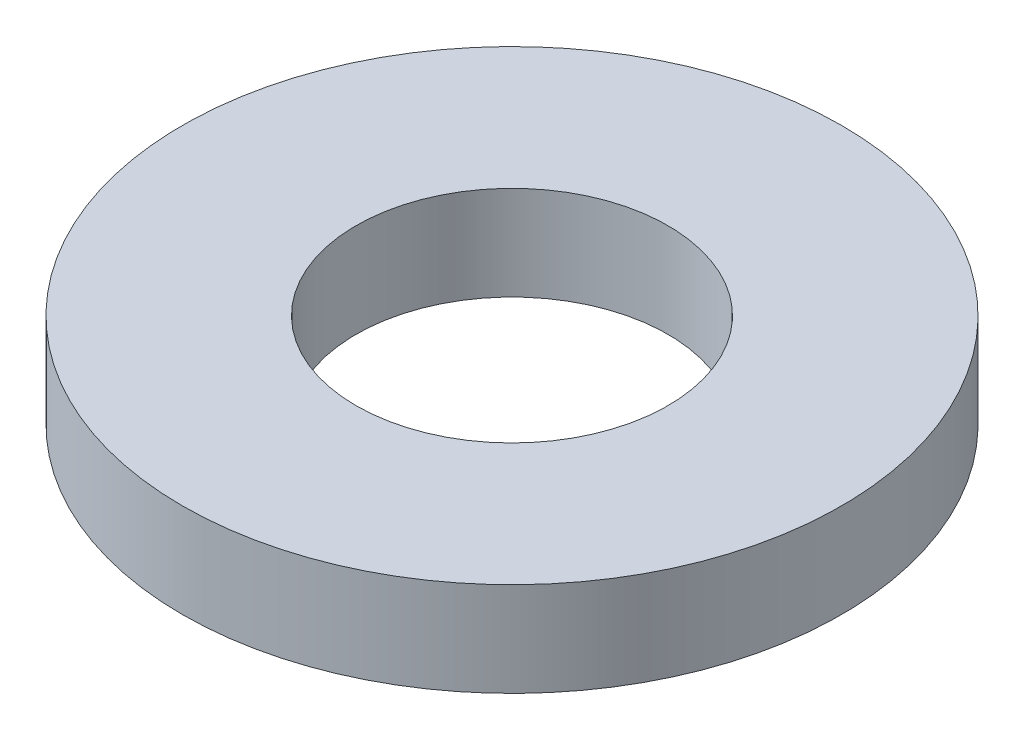
from build123d import *

# Parameters (mm, degrees)
SKETCH1_W = 1.475
SKETCH1_H = 0.8


with BuildPart() as part:
    # Sketch1 → Revolve2 (revolve)
    with BuildSketch(Plane(origin=(0, 0, 0), x_dir=(0, 0, -1), z_dir=(1, 0, 0)), mode=Mode.PRIVATE) as revolve2_sk:
        with Locations((2.0625, 0.72688172)):
            Rectangle(SKETCH1_W, SKETCH1_H)
    revolve(revolve2_sk.sketch.rotate(Axis((0, 39.676683284, 0), (0, -1, 0)), 180), axis=Axis((0, 39.676683284, 0), (0, -1, 0)))


solid = part.part
